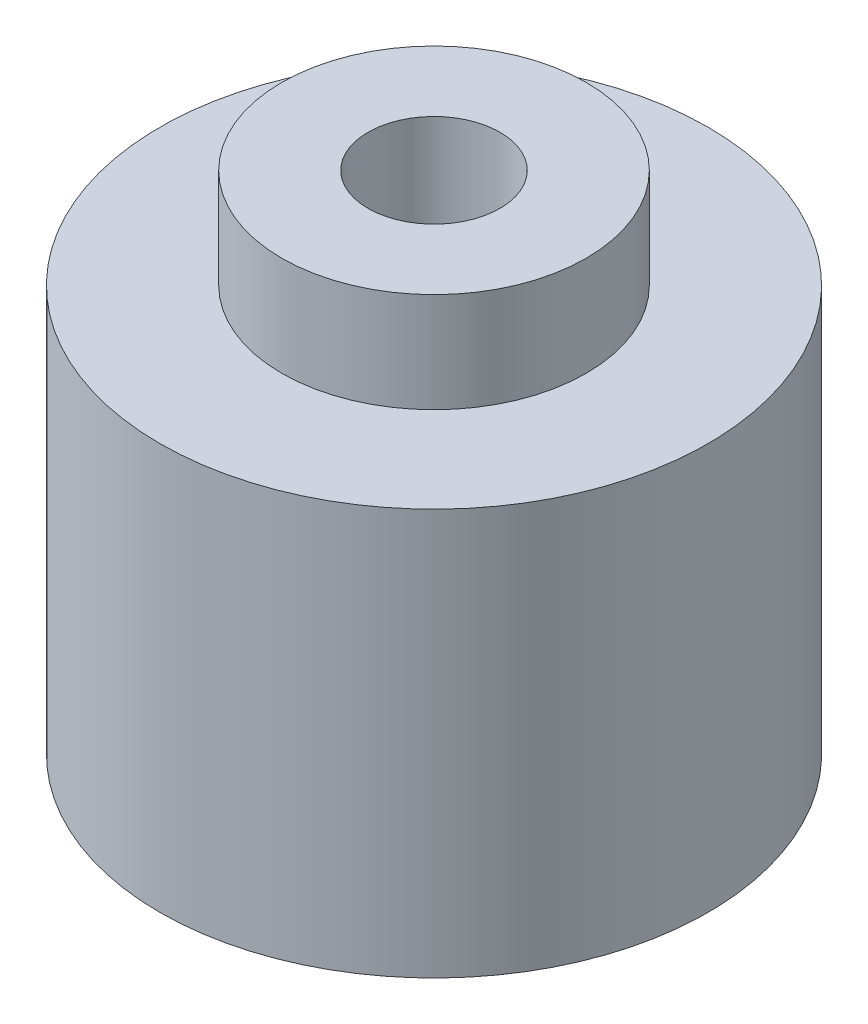
from build123d import *

# Parameters (mm, degrees)
SKETCH1_R           = 27
BOSS_EXTRUDE1_DEPTH = 40
SKETCH3_R           = 15
BOSS_EXTRUDE2_DEPTH = 9.818926242
SKETCH4_R           = 6.5
CUT_EXTRUDE3_DEPTH  = 55.119147002


with BuildPart() as part:
    # Sketch1 → Boss-Extrude1 (new body)
    with BuildSketch(Plane(origin=(0, 0, 0), x_dir=(1, 0, 0), z_dir=(0, 1, 0))):
        with Locations(Location((0, 0, 0), (0, 0, 270))):
            Circle(SKETCH1_R)
    extrude(amount=BOSS_EXTRUDE1_DEPTH)

    # Sketch3 → Boss-Extrude2 (add)
    with BuildSketch(Plane(origin=(0, 40, 0), x_dir=(1, 0, 0), z_dir=(0, 1, 0))):
        with Locations(Location((0, 0, 0), (0, 0, 270))):
            Circle(SKETCH3_R)
    extrude(amount=BOSS_EXTRUDE2_DEPTH)

    # Sketch4 → Cut-Extrude3 (cut)
    with BuildSketch(Plane(origin=(0, 49.818926242, 0), x_dir=(1, 0, 0), z_dir=(0, 1, 0))):
        with Locations(Location((0, 0, 0), (0, 0, 270))):
            Circle(SKETCH4_R)
    extrude(amount=-CUT_EXTRUDE3_DEPTH, mode=Mode.SUBTRACT)


solid = part.part
